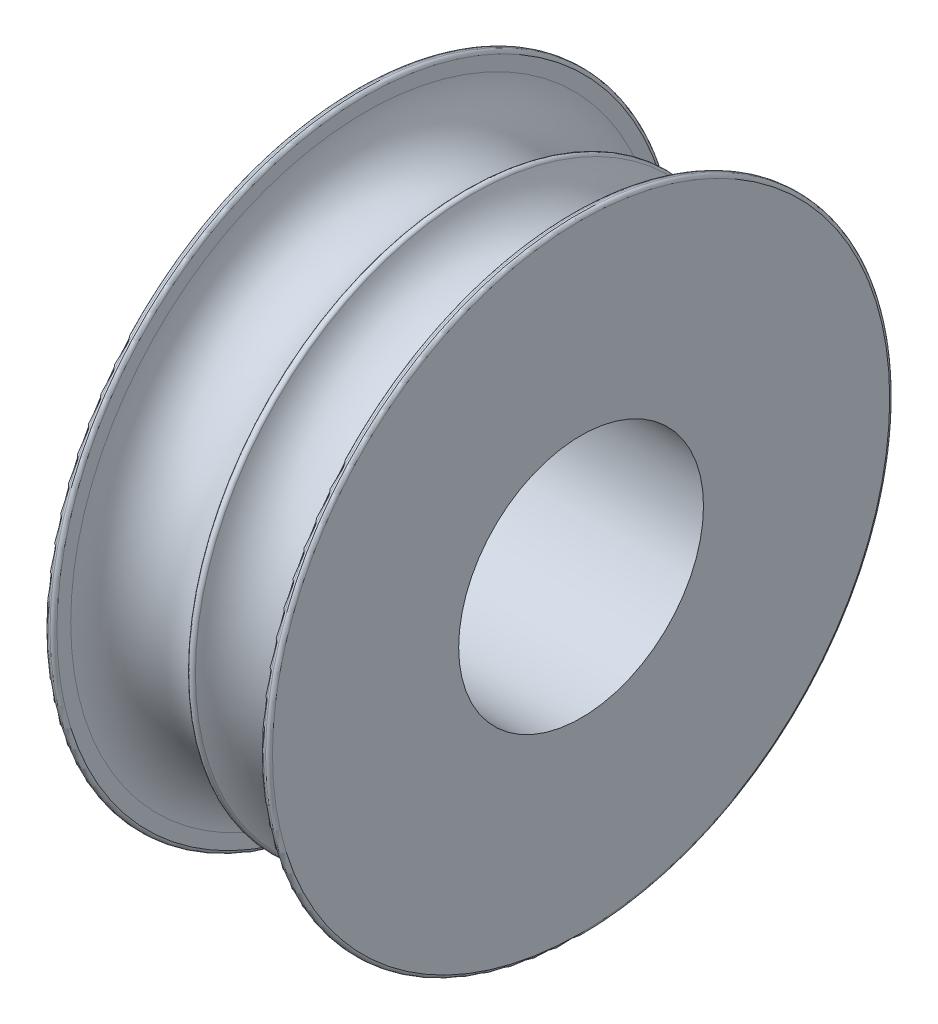
from build123d import *

# Parameters (mm, degrees)
CUT_EXTRUDE1_DEPTH      = 29.709231965
CUT_EXTRUDE1_DEPTH_BACK = 29.709231965
SKETCH2_R               = 7.1
FILLET1_R               = 0.2


with BuildPart() as part:
    # Sketch1 → Revolve1 (revolve)
    with BuildSketch(Plane(origin=(0, 0, 0), x_dir=(1, 0, 0), z_dir=(0, 1, 0)), mode=Mode.PRIVATE) as revolve1_sk:
        with BuildLine():
            Line((-13, 0), (0, 0))
            Line((0, 0), (0, 18.1))
            Line((0, 18.1), (-0.5, 18.1))
            Line((-0.5, 18.1), (-0.5, 17.1))
            ThreePointArc((-0.5, 17.1), (-3.5, 14.1), (-6.5, 17.1))
            ThreePointArc((-6.5, 17.1), (-9.5, 14.1), (-12.5, 17.1))
            Line((-12.5, 17.1), (-12.5, 18.1))
            Line((-12.5, 18.1), (-13, 18.1))
            Line((-13, 18.1), (-13, 0))
        make_face()
    revolve(revolve1_sk.sketch.rotate(Axis((-13, 0, 0), (1, 0, 0)), 180), axis=Axis((-13, 0, 0), (1, 0, 0)))

    # Sketch2 → Cut-Extrude1 (cut, two sides: drawn at the far end of the back side and taken through both)
    with BuildSketch(Plane(origin=(0, 0, 0), x_dir=(0, 0, -1), z_dir=(1, 0, 0)).offset(-CUT_EXTRUDE1_DEPTH_BACK)):
        Circle(SKETCH2_R)
    extrude(amount=CUT_EXTRUDE1_DEPTH + CUT_EXTRUDE1_DEPTH_BACK, mode=Mode.SUBTRACT)

    # Fillet1
    fillet1_edges = [part.edges().sort_by_distance(p)[0] for p in [
        (-0.5, 0, -18.1),
        (0, 0, -18.1),
        (-13, 0, -18.1),
        (-12.5, 0, -18.1),
        (-6.5, 0, -17.1),
    ]]
    fillet(fillet1_edges, radius=FILLET1_R)


solid = part.part
